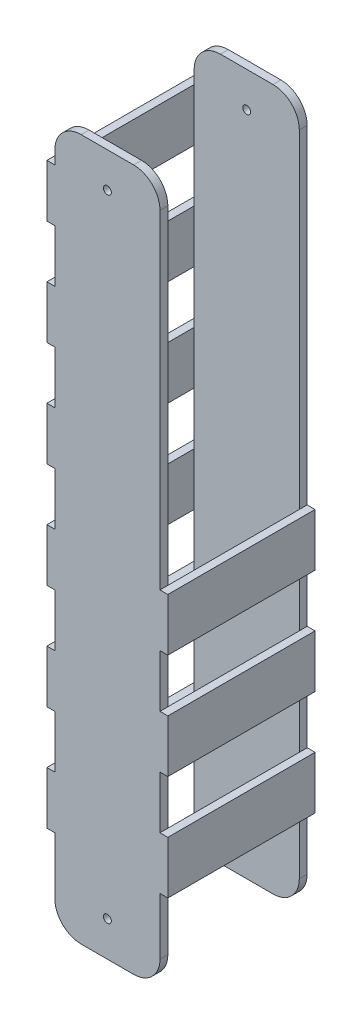
from build123d import *

# Parameters (mm, degrees)
BOSS_EXTRUDE1_START     = 50
BOSS_EXTRUDE1_DEPTH     = 3
BOSS_EXTRUDE2_DEPTH     = 3
CUT_EXTRUDE1_DEPTH      = 145.867832485
CUT_EXTRUDE1_DEPTH_BACK = 145.867832485
SKETCH2_R               = 1.5
SKETCH3_W               = 56
SKETCH3_H               = 20
BOSS_EXTRUDE4_DEPTH     = 3
SKETCH4_W               = 56
SKETCH4_H               = 20
BOSS_EXTRUDE5_DEPTH     = 3


with BuildPart() as part:
    # Sketch1 → Boss-Extrude1 (new body)
    with BuildSketch(Plane.XY.offset(BOSS_EXTRUDE1_START)):
        with BuildLine():
            Line((-10, 133.333), (10, 133.333))
            ThreePointArc((10, 133.333), (17.071067812, 130.404067812), (20, 123.333))
            Line((20, 123.333), (20, -123.333))
            ThreePointArc((20, -123.333), (17.071067812, -130.404067812), (10, -133.333))
            Line((10, -133.333), (-10, -133.333))
            ThreePointArc((-10, -133.333), (-17.071067812, -130.404067812), (-20, -123.333))
            Line((-20, -123.333), (-20, 123.333))
            ThreePointArc((-20, 123.333), (-17.071067812, 130.404067812), (-10, 133.333))
        make_face()
    extrude(amount=BOSS_EXTRUDE1_DEPTH)


with BuildPart() as body_2:
    # Sketch1<3> → Boss-Extrude2 (new body)
    with BuildSketch(Plane.XY):
        with BuildLine():
            Line((-10, 133.333), (10, 133.333))
            ThreePointArc((10, 133.333), (17.071067812, 130.404067812), (20, 123.333))
            Line((20, 123.333), (20, -123.333))
            ThreePointArc((20, -123.333), (17.071067812, -130.404067812), (10, -133.333))
            Line((10, -133.333), (-10, -133.333))
            ThreePointArc((-10, -133.333), (-17.071067812, -130.404067812), (-20, -123.333))
            Line((-20, -123.333), (-20, 123.333))
            ThreePointArc((-20, 123.333), (-17.071067812, 130.404067812), (-10, 133.333))
        make_face()
    extrude(amount=-BOSS_EXTRUDE2_DEPTH)


with BuildPart() as cut_extrude1_tool:
    # Sketch2 → Cut-Extrude1 (new, two sides: drawn at the far end of the back side and taken through both)
    with BuildSketch(Plane.XY.offset(-CUT_EXTRUDE1_DEPTH_BACK)):
        with Locations((0, 119.997946932)):
            Circle(SKETCH2_R)
        with Locations((0, -119.997946932)):
            Circle(SKETCH2_R)
    extrude(amount=CUT_EXTRUDE1_DEPTH + CUT_EXTRUDE1_DEPTH_BACK)


with BuildPart() as part_1:
    add(part.part)

    # Cut-Extrude1: cut by cut_extrude1_tool
    add(cut_extrude1_tool.part, mode=Mode.SUBTRACT)



with BuildPart() as body_2_1:
    add(body_2.part)

    # Cut-Extrude1: cut by cut_extrude1_tool
    add(cut_extrude1_tool.part, mode=Mode.SUBTRACT)


with BuildPart() as part_2:
    add(part_1.part)

    add(body_2_1.part)  # Boss-Extrude4 merges body 2
    # Sketch3 → Boss-Extrude4 (add)
    with BuildSketch(Plane.ZY.offset(20)):
        with Locations((25, 108.333)):
            Rectangle(SKETCH3_W, SKETCH3_H)
        with Locations((25, 68.333)):
            Rectangle(SKETCH3_W, SKETCH3_H)
        with Locations((25, 28.333)):
            Rectangle(SKETCH3_W, SKETCH3_H)
        with Locations((25, -11.667)):
            Rectangle(SKETCH3_W, SKETCH3_H)
        with Locations((25, -51.667)):
            Rectangle(SKETCH3_W, SKETCH3_H)
        with Locations((25, -91.667)):
            Rectangle(SKETCH3_W, SKETCH3_H)
    extrude(amount=BOSS_EXTRUDE4_DEPTH)

    # Sketch4 → Boss-Extrude5 (add)
    with BuildSketch(Plane(origin=(20, 0, 0), x_dir=(0, 0, -1), z_dir=(1, 0, 0))):
        with Locations((-25, -51.667)):
            Rectangle(SKETCH4_W, SKETCH4_H)
        with Locations((-25, -11.667)):
            Rectangle(SKETCH4_W, SKETCH4_H)
        with Locations((-25, -91.667)):
            Rectangle(SKETCH4_W, SKETCH4_H)
    extrude(amount=BOSS_EXTRUDE5_DEPTH)


solid = part_2.part
